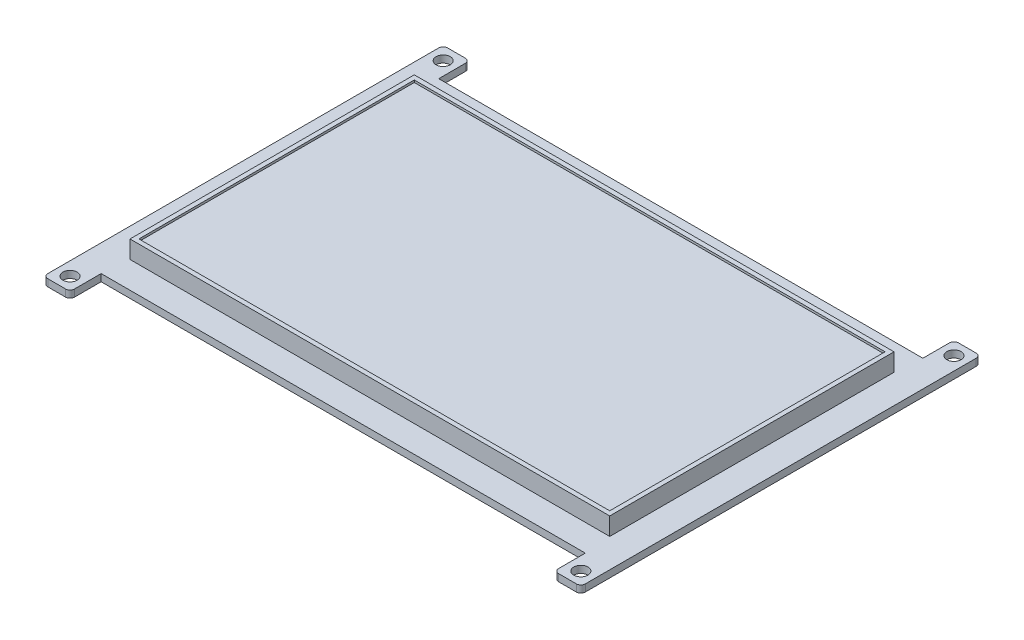
from build123d import *

# Parameters (mm, degrees)
SKETCH_1_R          = 1.6
EXTRUDE_1_DEPTH     = 1.6
SKETCH_2_W          = 108
SKETCH_2_H          = 64
EXTRUDE_2_DEPTH     = 4
SKETCH_3_W          = 106
SKETCH_3_H          = 62
CUT_EXTRUDE_1_DEPTH = 0.5


with BuildPart() as part:
    # 草图1 → 凸台-拉伸1 (new body)
    with BuildSketch(Plane(origin=(0, 0, 0), x_dir=(1, 0, 0), z_dir=(0, 1, 0))):
        with BuildLine():
            Line((54.5, 44), (54.5, 38))
            Line((54.5, 38), (-54.5, 38))
            Line((-54.5, 38), (-54.5, 44))
            ThreePointArc((-54.5, 44), (-54.792893219, 44.707106781), (-55.5, 45))
            Line((-55.5, 45), (-59.5, 45))
            ThreePointArc((-59.5, 45), (-60.207106781, 44.707106781), (-60.5, 44))
            Line((-60.5, 44), (-60.5, 38))
            Line((-60.5, 38), (-60.5, -38))
            Line((-60.5, -38), (-60.5, -44))
            ThreePointArc((-60.5, -44), (-60.207106781, -44.707106781), (-59.5, -45))
            Line((-59.5, -45), (-55.5, -45))
            ThreePointArc((-55.5, -45), (-54.792893219, -44.707106781), (-54.5, -44))
            Line((-54.5, -44), (-54.5, -38))
            Line((-54.5, -38), (54.5, -38))
            Line((54.5, -38), (54.5, -44))
            ThreePointArc((54.5, -44), (54.792893219, -44.707106781), (55.5, -45))
            Line((55.5, -45), (59.5, -45))
            ThreePointArc((59.5, -45), (60.207106781, -44.707106781), (60.5, -44))
            Line((60.5, -44), (60.5, 38))
            Line((60.5, 38), (60.5, 44))
            ThreePointArc((60.5, 44), (60.207106781, 44.707106781), (59.5, 45))
            Line((59.5, 45), (55.5, 45))
            ThreePointArc((55.5, 45), (54.792893219, 44.707106781), (54.5, 44))
        make_face()
        with Locations(Location((-57.5, -42, 0), (0, 0, 270))):
            Circle(SKETCH_1_R, mode=Mode.SUBTRACT)
        with Locations(Location((57.5, -42, 0), (0, 0, 270))):
            Circle(SKETCH_1_R, mode=Mode.SUBTRACT)
        with Locations(Location((-57.5, 42, 0), (0, 0, 270))):
            Circle(SKETCH_1_R, mode=Mode.SUBTRACT)
        with Locations(Location((57.5, 42, 0), (0, 0, 270))):
            Circle(SKETCH_1_R, mode=Mode.SUBTRACT)
    extrude(amount=EXTRUDE_1_DEPTH)

    # 草图2 → 凸台-拉伸2 (add)
    with BuildSketch(Plane(origin=(0, 1.6, 0), x_dir=(1, 0, 0), z_dir=(0, 1, 0))):
        Rectangle(SKETCH_2_W, SKETCH_2_H)
    extrude(amount=EXTRUDE_2_DEPTH)

    # 草图3 → 切除-拉伸1 (cut)
    with BuildSketch(Plane(origin=(0, 5.6, 0), x_dir=(1, 0, 0), z_dir=(0, 1, 0))):
        Rectangle(SKETCH_3_W, SKETCH_3_H)
    extrude(amount=-CUT_EXTRUDE_1_DEPTH, mode=Mode.SUBTRACT)


solid = part.part
